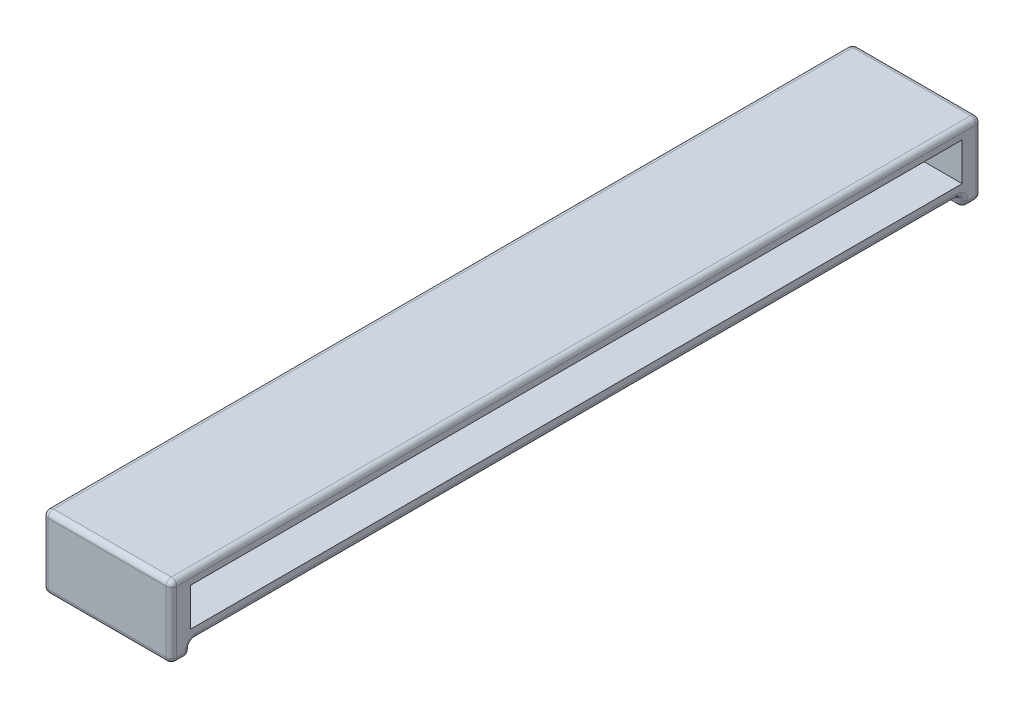
from build123d import *

# Parameters (mm, degrees)
BOSS_EXTRUDE1_DEPTH = 0.75
SKETCH2_W           = 8.459553448
SKETCH2_H           = 1.25
BOSS_EXTRUDE2_DEPTH = 0.75
BOSS_EXTRUDE3_DEPTH = 1.25
LPATTERN1_COUNT     = 10
LPATTERN1_PITCH     = 5.068
BOSS_EXTRUDE4_DEPTH = 2.5
SKETCH5_W           = 8.459553448
SKETCH5_H           = 53.3
BOSS_EXTRUDE5_DEPTH = 0.75
FILLET1_R           = 0.35


with BuildPart() as part:
    # Sketch1 → Boss-Extrude1 (new body)
    with BuildSketch(Plane(origin=(0, 0, 0), x_dir=(1, 0, 0), z_dir=(0, 1, 0))):
        Polygon((-17.603069868, -25.4), (-17.603069868, 25.4), (-17.603069868, 26.65), (-9.14351642, 26.65), (-9.14351642, 25.4), (-9.14351642, -25.4), (-9.14351642, -26.65), (-17.603069868, -26.65), align=None)
    extrude(amount=BOSS_EXTRUDE1_DEPTH)

    # Sketch2 → Boss-Extrude2 (add)
    with BuildSketch(Plane.XZ):
        with Locations((-13.373293144, 26.025)):
            Rectangle(SKETCH2_W, SKETCH2_H)
        with Locations((-13.373293144, -26.025)):
            Rectangle(SKETCH2_W, SKETCH2_H)
    extrude(amount=BOSS_EXTRUDE2_DEPTH)

    # Sketch3 → Boss-Extrude3 (add)
    with BuildSketch(Plane.XZ):
        with BuildLine():
            Line((-17.603069868, -24.3), (-12.103069868, -24.3))
            ThreePointArc((-12.103069868, -24.3), (-10.603069868, -22.8), (-12.103069868, -21.3))
            Line((-12.103069868, -21.3), (-17.603069868, -21.3))
            Line((-17.603069868, -21.3), (-17.603069868, -24.3))
        make_face()
    boss_extrude3 = extrude(amount=BOSS_EXTRUDE3_DEPTH)

    # LPattern1: Boss-Extrude3 ×10
    with Locations(*[(0, 0, i * LPATTERN1_PITCH) for i in range(1, LPATTERN1_COUNT)]):
        add(boss_extrude3)

    # Sketch4 → Boss-Extrude4 (add)
    with BuildSketch(Plane(origin=(0, 0.75, 0), x_dir=(1, 0, 0), z_dir=(0, 1, 0))):
        Polygon((-17.603069868, -25.4), (-17.603069868, 25.4), (-17.603069868, 26.65), (-9.14351642, 26.65), (-9.14351642, 25.4), (-16.353069868, 25.4), (-16.353069868, -25.4), (-9.14351642, -25.4), (-9.14351642, -26.65), (-17.603069868, -26.65), align=None)
    extrude(amount=BOSS_EXTRUDE4_DEPTH)

    # Sketch5 → Boss-Extrude5 (add)
    with BuildSketch(Plane(origin=(0, 3.25, 0), x_dir=(1, 0, 0), z_dir=(0, 1, 0))):
        with Locations((-13.373293144, 0)):
            Rectangle(SKETCH5_W, SKETCH5_H)
    extrude(amount=BOSS_EXTRUDE5_DEPTH)

    # Fillet1
    fillet1_edges = [part.edges().sort_by_distance(p)[0] for p in [
        (-14.853069868, -1.25, -4.028),
        (-10.603069868, -1.25, -2.528),
        (-14.853069868, -1.25, -1.028),
        (-17.603069868, 0, 5.074),
        (-17.603069868, -0.625, 4.04),
        (-14.853069868, 0, 1.04),
        (-17.603069868, -0.625, 1.04),
        (-10.603069868, 0, 2.54),
        (-14.853069868, 0, 4.04),
        (-17.603069868, -1.25, 2.54),
        (-14.853069868, -1.25, 1.04),
        (-10.603069868, -1.25, 2.54),
        (-14.853069868, -1.25, 4.04),
        (-17.603069868, 0, 10.142),
        (-17.603069868, -0.625, 9.108),
        (-14.853069868, 0, 6.108),
        (-17.603069868, -0.625, 6.108),
        (-10.603069868, 0, 7.608),
        (-14.853069868, 0, 9.108),
        (-17.603069868, -1.25, 7.608),
        (-14.853069868, -1.25, 6.108),
        (-10.603069868, -1.25, 7.608),
        (-14.853069868, -1.25, 9.108),
        (-17.603069868, 0, 15.21),
        (-17.603069868, -0.625, 14.176),
        (-14.853069868, 0, 11.176),
        (-17.603069868, -0.625, 11.176),
        (-10.603069868, 0, 12.676),
        (-14.853069868, 0, 14.176),
        (-17.603069868, -1.25, 12.676),
        (-14.853069868, -1.25, 11.176),
        (-10.603069868, -1.25, 12.676),
        (-14.853069868, -1.25, 14.176),
        (-17.603069868, 0, 20.278),
        (-17.603069868, -0.625, 19.244),
        (-14.853069868, 0, 16.244),
        (-17.603069868, -0.625, 16.244),
        (-10.603069868, 0, 17.744),
        (-14.853069868, 0, 19.244),
        (-17.603069868, -1.25, 17.744),
        (-14.853069868, -1.25, 16.244),
        (-10.603069868, -1.25, 17.744),
        (-14.853069868, -1.25, 19.244),
        (-17.603069868, 1.625, -26.65),
        (-9.14351642, 1.625, -26.65),
        (-9.14351642, 1.625, 26.65),
        (-17.603069868, 1.625, 26.65),
        (-17.603069868, 0, 24.856),
        (-17.603069868, -0.625, 24.312),
        (-14.853069868, 0, 21.312),
        (-17.603069868, -0.625, 21.312),
        (-10.603069868, 0, 22.812),
        (-14.853069868, 0, 24.312),
        (-17.603069868, -1.25, 22.812),
        (-14.853069868, -1.25, 21.312),
        (-10.603069868, -1.25, 22.812),
        (-14.853069868, -1.25, 24.312),
        (-17.603069868, 4, 0),
        (-13.373293144, 4, 26.65),
        (-9.14351642, 4, 0),
        (-13.373293144, 4, -26.65),
        (-9.14351642, 0, 0),
        (-9.14351642, -0.375, 25.4),
        (-13.373293144, 0, 25.4),
        (-17.603069868, -0.375, 25.4),
        (-9.14351642, -0.75, 26.025),
        (-13.373293144, -0.75, 26.65),
        (-17.603069868, -0.75, 26.025),
        (-13.373293144, -0.75, 25.4),
        (-17.603069868, 0, -24.85),
        (-13.373293144, 0, -25.4),
        (-9.14351642, -0.375, -25.4),
        (-17.603069868, -0.375, -25.4),
        (-9.14351642, -0.75, -26.025),
        (-13.373293144, -0.75, -25.4),
        (-17.603069868, -0.75, -26.025),
        (-13.373293144, -0.75, -26.65),
        (-17.603069868, 0, -20.266),
        (-17.603069868, -0.625, -21.3),
        (-14.853069868, 0, -24.3),
        (-17.603069868, -0.625, -24.3),
        (-10.603069868, 0, -22.8),
        (-14.853069868, 0, -21.3),
        (-17.603069868, -1.25, -22.8),
        (-14.853069868, -1.25, -24.3),
        (-10.603069868, -1.25, -22.8),
        (-14.853069868, -1.25, -21.3),
        (-17.603069868, 0, -15.198),
        (-17.603069868, -0.625, -16.232),
        (-14.853069868, 0, -19.232),
        (-17.603069868, -0.625, -19.232),
        (-10.603069868, 0, -17.732),
        (-14.853069868, 0, -16.232),
        (-17.603069868, -1.25, -17.732),
        (-14.853069868, -1.25, -19.232),
        (-10.603069868, -1.25, -17.732),
        (-14.853069868, -1.25, -16.232),
        (-17.603069868, 0, -10.13),
        (-17.603069868, -0.625, -11.164),
        (-14.853069868, 0, -14.164),
        (-17.603069868, -0.625, -14.164),
        (-10.603069868, 0, -12.664),
        (-14.853069868, 0, -11.164),
        (-17.603069868, -1.25, -12.664),
        (-14.853069868, -1.25, -14.164),
        (-10.603069868, -1.25, -12.664),
        (-14.853069868, -1.25, -11.164),
        (-17.603069868, 0, -5.062),
        (-17.603069868, -0.625, -6.096),
        (-14.853069868, 0, -9.096),
        (-17.603069868, -0.625, -9.096),
        (-10.603069868, 0, -7.596),
        (-14.853069868, 0, -6.096),
        (-17.603069868, -1.25, -7.596),
        (-14.853069868, -1.25, -9.096),
        (-10.603069868, -1.25, -7.596),
        (-14.853069868, -1.25, -6.096),
        (-17.603069868, 0, 0.006),
        (-17.603069868, -0.625, -1.028),
        (-14.853069868, 0, -4.028),
        (-17.603069868, -0.625, -4.028),
        (-10.603069868, 0, -2.528),
        (-14.853069868, 0, -1.028),
        (-17.603069868, -1.25, -2.528),
    ]]
    fillet(fillet1_edges, radius=FILLET1_R)


solid = part.part
